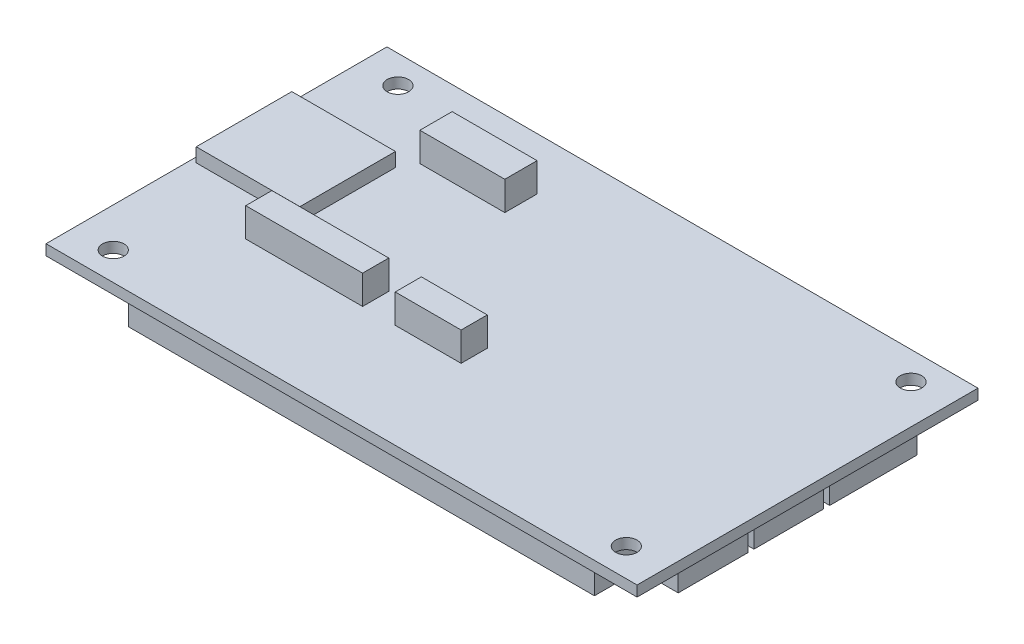
from build123d import *

# Parameters (mm, degrees)
SKETCH2_W           = 87
SKETCH2_H           = 50.18
SKETCH2_R           = 1.575
BOSS_EXTRUDE2_DEPTH = 1.55
SKETCH3_W           = 15.26
SKETCH3_H           = 14.07
BOSS_EXTRUDE3_DEPTH = 2.05
SKETCH4_W           = 17.2
SKETCH4_H           = 3.85
SKETCH4_W_2         = 9.7
SKETCH4_W_3         = 12.5
SKETCH4_H_2         = 4.75
BOSS_EXTRUDE4_DEPTH = 4.25
SKETCH7_W           = 68.55
SKETCH7_H           = 12.2
BOSS_EXTRUDE5_DEPTH = 4.65
SKETCH10_W          = 10.85
SKETCH10_H          = 7.15
BOSS_EXTRUDE6_DEPTH = 3.34
SKETCH11_W          = 5.7
SKETCH11_H          = 13
BOSS_EXTRUDE7_DEPTH = 2.7
SKETCH15_W          = 4.87
SKETCH15_H          = 10.25
SKETCH15_H_2        = 12.85
BOSS_EXTRUDE9_DEPTH = 3.68


with BuildPart() as part:
    # Sketch2 → Boss-Extrude2 (new body)
    with BuildSketch(Plane(origin=(0, 0, 0), x_dir=(1, 0, 0), z_dir=(0, 1, 0))):
        with Locations((-0.010528039, -0.006072379)):
            Rectangle(SKETCH2_W, SKETCH2_H)
        with Locations((-37.760528039, 20.948927621)):
            Circle(SKETCH2_R, mode=Mode.SUBTRACT)
        with Locations((-37.760528039, -20.948927621)):
            Circle(SKETCH2_R, mode=Mode.SUBTRACT)
        with Locations((37.760528039, -20.948927621)):
            Circle(SKETCH2_R, mode=Mode.SUBTRACT)
        with Locations((37.760528039, 20.948927621)):
            Circle(SKETCH2_R, mode=Mode.SUBTRACT)
    extrude(amount=BOSS_EXTRUDE2_DEPTH)

    # Sketch3 → Boss-Extrude3 (add)
    with BuildSketch(Plane(origin=(0, 1.55, 0), x_dir=(1, 0, 0), z_dir=(0, 1, 0))):
        with Locations((-35.130528039, 3.298927621)):
            Rectangle(SKETCH3_W, SKETCH3_H)
    extrude(amount=BOSS_EXTRUDE3_DEPTH)

    # Sketch4 → Boss-Extrude4 (add)
    with BuildSketch(Plane(origin=(0, 1.55, 0), x_dir=(1, 0, 0), z_dir=(0, 1, 0))):
        with Locations((-20.810528039, -7.871072379)):
            Rectangle(SKETCH4_W, SKETCH4_H)
        with Locations((-2.560528039, -7.871072379)):
            Rectangle(SKETCH4_W_2, SKETCH4_H)
        with Locations((-19.960528039, 15.008927621)):
            Rectangle(SKETCH4_W_3, SKETCH4_H_2)
    extrude(amount=BOSS_EXTRUDE4_DEPTH)

    # Sketch7 → Boss-Extrude5 (add)
    with BuildSketch(Plane(origin=(0, 0, 0), x_dir=(-1, 0, 0), z_dir=(0, -1, 0))):
        with Locations((-1.25778805, -17.316072379)):
            Rectangle(SKETCH7_W, SKETCH7_H)
    extrude(amount=BOSS_EXTRUDE5_DEPTH)

    # Sketch10 → Boss-Extrude6 (add)
    with BuildSketch(Plane.XZ):
        with Locations((-7.185528039, -21.508927621)):
            Rectangle(SKETCH10_W, SKETCH10_H)
    extrude(amount=BOSS_EXTRUDE6_DEPTH)

    # Sketch11 → Boss-Extrude7 (add)
    with BuildSketch(Plane.XZ):
        with Locations((-41.560528039, 8.346072379)):
            Rectangle(SKETCH11_W, SKETCH11_H)
        with Locations((-41.560528039, -9.053927621)):
            Rectangle(SKETCH11_W, SKETCH11_H)
    extrude(amount=BOSS_EXTRUDE7_DEPTH)

    # Sketch15 → Boss-Extrude9 (add)
    with BuildSketch(Plane.XZ):
        with Locations((39.867059602, 12.730529287)):
            Rectangle(SKETCH15_W, SKETCH15_H)
        with Locations((39.867059602, 1.580529287)):
            Rectangle(SKETCH15_W, SKETCH15_H)
        with Locations((39.867059602, -10.869470713)):
            Rectangle(SKETCH15_W, SKETCH15_H_2)
    extrude(amount=BOSS_EXTRUDE9_DEPTH)


solid = part.part
